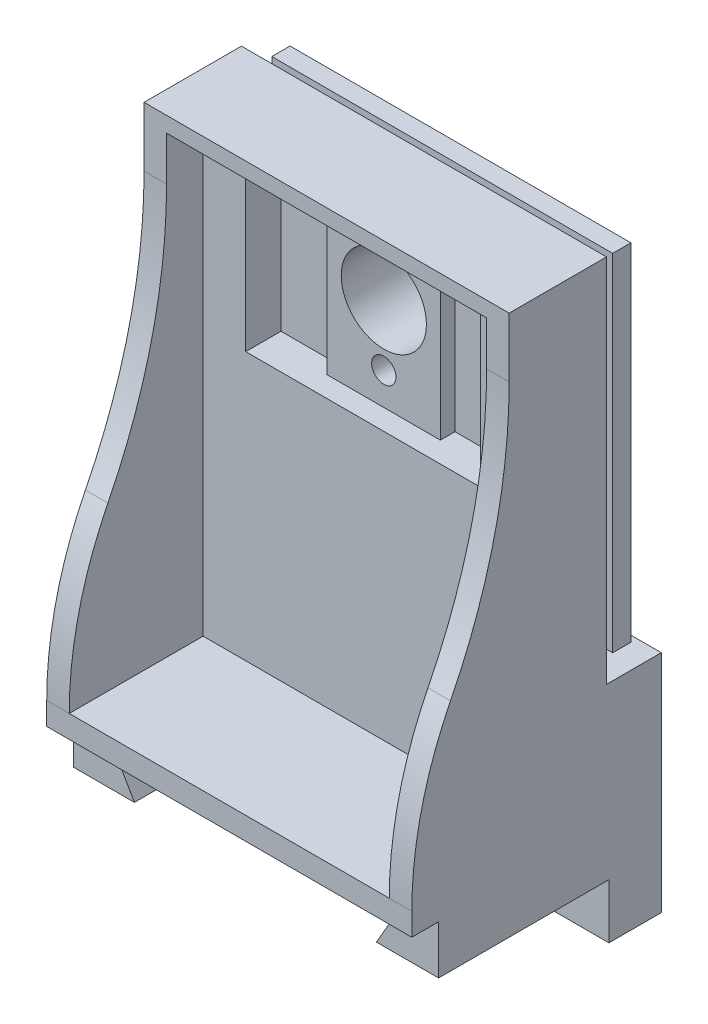
from build123d import *

# Parameters (mm, degrees)
SKETCH2_W               = 30
SKETCH2_H               = 18.5
BOSS_EXTRUDE1_DEPTH     = 4.5
BOSS_EXTRUDE2_DEPTH     = 5
SKETCH4_W               = 26.3
SKETCH4_H               = 37.3
BOSS_EXTRUDE3_DEPTH     = 9
SKETCH5_W               = 30
SKETCH5_H               = 40.415903306
SKETCH5_W_2             = 26.3
SKETCH5_H_2             = 37.3
BOSS_EXTRUDE4_DEPTH     = 2
CUT_EXTRUDE1_DEPTH      = 53.877515324
SKETCH7_R               = 2.75
CUT_EXTRUDE2_DEPTH      = 3
SKETCH8_R               = 1.65
CUT_EXTRUDE3_DEPTH      = 51.656012741
SKETCH9_W               = 0.2
SKETCH9_H               = 4
TOLERANCE_CUT1_DEPTH    = 53.877515324
TOLERANCE_CUT2_DEPTH    = 0.2
SKETCH12_W              = 26.022193388
SKETCH12_H              = 26.438096694
BOSS_EXTRUDE6_DEPTH     = 1.5
SKETCH13_W              = 28.011096694
SKETCH13_H              = 28.427
BOSS_EXTRUDE7_DEPTH     = 1.5
SKETCH16_W              = 1.5
SKETCH16_H              = 1.5
SILICONE_CHANNELS_DEPTH = 3
SKETCH19_W              = 19.3
SKETCH19_H              = 15.3
PCB_CAVITY_DEPTH        = 1.7
SKETCH15_R              = 1
PCB_MOUNT_HOLES_DEPTH   = 5
SKETCH20_W              = 5
SKETCH20_H              = 15.3
SOLDER_CAVITY_DEPTH     = 1.2
SKETCH21_R              = 0.5
AUDIO_CHANNEL_DEPTH     = 50.204386256
SKETCH22_R              = 3.5
CUT_EXTRUDE13_DEPTH     = 52.193570171


with BuildPart() as part:
    # Sketch2 → Boss-Extrude1 (new body)
    with BuildSketch(Plane.XY):
        with Locations((13, -1.25)):
            Rectangle(SKETCH2_W, SKETCH2_H)
    extrude(amount=BOSS_EXTRUDE1_DEPTH)

    # Sketch3 → Boss-Extrude2 (add)
    with BuildSketch(Plane.XY.offset(4.5)):
        Polygon((-2, 38.415903306), (28, 38.415903306), (28, -6), (22.890598923, -6), (25.2, -2), (0.7, -2), (3.009401077, -6), (-2, -6), align=None)
    extrude(amount=BOSS_EXTRUDE2_DEPTH)

    # Sketch4 → Boss-Extrude3 (add)
    with BuildSketch(Plane.XY.offset(9.5)):
        Polygon((-2, 38.415903306), (-2, -6), (3.009401077, -6), (0.7, -2), (25.2, -2), (22.890598923, -6), (28, -6), (28, 38.415903306), align=None)
        with Locations((13, 18.5)):
            Rectangle(SKETCH4_W, SKETCH4_H, mode=Mode.SUBTRACT)
    extrude(amount=BOSS_EXTRUDE3_DEPTH)

    # Sketch5 → Boss-Extrude4 (add)
    with BuildSketch(Plane.XY.offset(18.5)):
        with Locations((13, 18.207951653)):
            Rectangle(SKETCH5_W, SKETCH5_H)
        with Locations((13, 18.5)):
            Rectangle(SKETCH5_W_2, SKETCH5_H_2, mode=Mode.SUBTRACT)
    extrude(amount=BOSS_EXTRUDE4_DEPTH)

    # Sketch6 → Cut-Extrude1 (cut, through all)
    with BuildSketch(Plane(origin=(28, 0, 0), x_dir=(0, 0, -1), z_dir=(1, 0, 0))):
        with BuildLine():
            Line((-12.5, 38.415903306), (-29.920257518, 38.415903306))
            Line((-29.920257518, 38.415903306), (-29.920257518, -0.15))
            Line((-29.920257518, -0.15), (-20.5, -0.15))
            ThreePointArc((-20.5, -0.15), (-19.694107493, 6.728151663), (-17.320084205, 13.23372208))
            ThreePointArc((-17.320084205, 13.23372208), (-13.721563712, 23.094799932), (-12.5, 33.520632668))
            Line((-12.5, 33.520632668), (-12.5, 38.415903306))
        make_face()
    extrude(amount=-CUT_EXTRUDE1_DEPTH, mode=Mode.SUBTRACT)

    # Sketch7 → Cut-Extrude2 (cut)
    with BuildSketch(Plane(origin=(0, 0, 0), x_dir=(-1, 0, 0), z_dir=(0, 0, -1))):
        with Locations((-19.5, -6.25)):
            Circle(SKETCH7_R)
        with Locations(Location((-6.5, -6.25, 0), (0, 0, 180))):
            Circle(SKETCH7_R)
    extrude(amount=-CUT_EXTRUDE2_DEPTH, mode=Mode.SUBTRACT)

    # Sketch8 → Cut-Extrude3 (cut, through all)
    with BuildSketch(Plane(origin=(0, 0, 3), x_dir=(-1, 0, 0), z_dir=(0, 0, -1))):
        with Locations((-19.5, -6.25)):
            Circle(SKETCH8_R)
        with Locations((-6.5, -6.25)):
            Circle(SKETCH8_R)
    extrude(amount=-CUT_EXTRUDE3_DEPTH, mode=Mode.SUBTRACT)

    # Sketch9 → tolerance_cut1 (cut, through all)
    with BuildSketch(Plane.ZY.offset(2)):
        with Locations((18.4, -4)):
            Rectangle(SKETCH9_W, SKETCH9_H)
    extrude(amount=-TOLERANCE_CUT1_DEPTH, mode=Mode.SUBTRACT)

    # Sketch10 → tolerance_cut2 (cut)
    with BuildSketch(Plane.XY.offset(4.5)):
        Polygon((28, -6), (22.890598923, -6), (25.2, -2), (0.7, -2), (3.009401077, -6), (-2, -6), (-2, -10.5), (28, -10.5), align=None)
    extrude(amount=-TOLERANCE_CUT2_DEPTH, mode=Mode.SUBTRACT)

    # Sketch12 → Boss-Extrude6 (add)
    with BuildSketch(Plane(origin=(0, 0, 4.5), x_dir=(-1, 0, 0), z_dir=(0, 0, -1))):
        with Locations((-13, 23.207951653)):
            Rectangle(SKETCH12_W, SKETCH12_H)
    extrude(amount=BOSS_EXTRUDE6_DEPTH)

    # Sketch13 → Boss-Extrude7 (add)
    with BuildSketch(Plane(origin=(0, 0, 3), x_dir=(-1, 0, 0), z_dir=(0, 0, -1))):
        with Locations((-13, 23.207951653)):
            Rectangle(SKETCH13_W, SKETCH13_H)
    extrude(amount=BOSS_EXTRUDE7_DEPTH)

    # Sketch16 → silicone_channels (cut)
    with BuildSketch(Plane(origin=(0, 0, 1.5), x_dir=(-1, 0, 0), z_dir=(0, 0, -1))):
        with Locations((-25.261096694, 25.419380652)):
            Rectangle(SKETCH16_W, SKETCH16_H)
        with Locations((-25.261096694, 31.419380652)):
            Rectangle(SKETCH16_W, SKETCH16_H)
        with Locations((-25.261096694, 19.419380652)):
            Rectangle(SKETCH16_W, SKETCH16_H)
        with Locations((-25.261096694, 13.419380652)):
            Rectangle(SKETCH16_W, SKETCH16_H)
        with Locations((-21.014935628, 10.738903306)):
            Rectangle(SKETCH16_W, SKETCH16_H)
        with Locations((-19.514935628, 35.677)):
            Rectangle(SKETCH16_W, SKETCH16_H)
        with Locations((-4.985064372, 10.738903306)):
            Rectangle(SKETCH16_W, SKETCH16_H)
        with Locations((-0.738903306, 13.419380652)):
            Rectangle(SKETCH16_W, SKETCH16_H)
        with Locations((-0.738903306, 19.419380652)):
            Rectangle(SKETCH16_W, SKETCH16_H)
        with Locations((-0.738903306, 25.419380652)):
            Rectangle(SKETCH16_W, SKETCH16_H)
        with Locations((-0.738903306, 31.419380652)):
            Rectangle(SKETCH16_W, SKETCH16_H)
        with Locations((-6.485064372, 35.677)):
            Rectangle(SKETCH16_W, SKETCH16_H)
    extrude(amount=-SILICONE_CHANNELS_DEPTH, mode=Mode.SUBTRACT)

    # Sketch19 → pcb_cavity (cut)
    with BuildSketch(Plane.XY.offset(9.5)):
        with Locations((13, 29.5)):
            Rectangle(SKETCH19_W, SKETCH19_H)
    extrude(amount=-PCB_CAVITY_DEPTH, mode=Mode.SUBTRACT)

    # Sketch15 → pcb_mount_holes (cut)
    with BuildSketch(Plane.XY.offset(7.8)):
        with Locations((13, 34.5)):
            Circle(SKETCH15_R)
        with Locations((13, 24.5)):
            Circle(SKETCH15_R)
    extrude(amount=-PCB_MOUNT_HOLES_DEPTH, mode=Mode.SUBTRACT)

    # Sketch20 → solder_cavity (cut)
    with BuildSketch(Plane.XY.offset(7.8)):
        with Locations((5.85, 29.5)):
            Rectangle(SKETCH20_W, SKETCH20_H)
        with Locations((20.15, 29.5)):
            Rectangle(SKETCH20_W, SKETCH20_H)
    extrude(amount=-SOLDER_CAVITY_DEPTH, mode=Mode.SUBTRACT)

    # Sketch21 → audio_channel (cut, through all)
    with BuildSketch(Plane.XY.offset(7.8)):
        with Locations((13, 29.5)):
            Circle(SKETCH21_R)
    extrude(amount=-AUDIO_CHANNEL_DEPTH, mode=Mode.SUBTRACT)

    # Sketch22 → Cut-Extrude13 (cut, through all)
    with BuildSketch(Plane(origin=(0, 0, 1.5), x_dir=(-1, 0, 0), z_dir=(0, 0, -1))):
        with Locations((-13, 29.5)):
            Circle(SKETCH22_R)
    extrude(amount=-CUT_EXTRUDE13_DEPTH, mode=Mode.SUBTRACT)


solid = part.part
